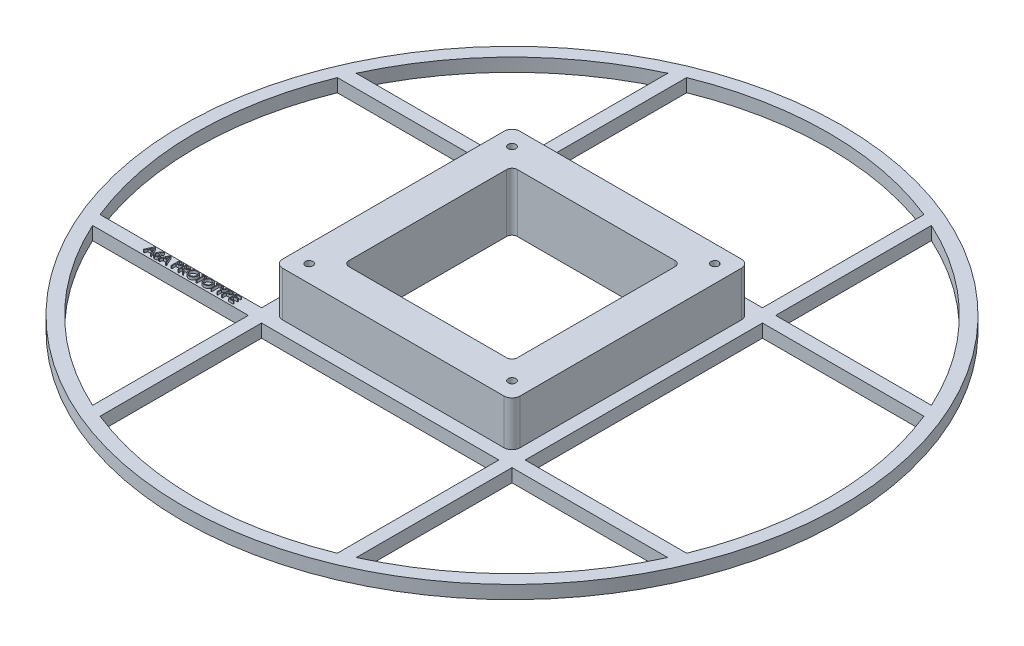
from build123d import *

# Parameters (mm, degrees)
SKETCH1_R                                     = 125
SKETCH1_R_2                                   = 120
BOSS_EXTRUDE1_DEPTH                           = 5
SKETCH1_W                                     = 100
SKETCH1_H                                     = 100
BOSS_EXTRUDE1_2_DEPTH                         = 5
BOSS_EXTRUDE2_REACH                           = 217.116
BOSS_EXTRUDE2_END_RADIUS                      = 120
SKETCH2_W                                     = 5
SKETCH2_H                                     = 5
MIRROR1_AT_THE_SECOND_PLANE_COPY_1_REACH      = 217.116
MIRROR1_AT_THE_SECOND_PLANE_COPY_1_END_RADIUS = 120
MIRROR1_AT_THE_SECOND_PLANE_COPY_1_SKETC_W    = 5
MIRROR1_AT_THE_SECOND_PLANE_COPY_1_SKETC_H    = 5
MIRROR3_COPY_1_REACH                          = 217.116
MIRROR3_COPY_1_END_RADIUS                     = 120
MIRROR3_COPY_1_SKETCH_W                       = 5
MIRROR3_COPY_1_SKETCH_H                       = 5
MIRROR3_COPY_2_REACH                          = 217.116
MIRROR3_COPY_2_END_RADIUS                     = 120
MIRROR3_COPY_2_SKETCH_W                       = 5
MIRROR3_COPY_2_SKETCH_H                       = 5
MIRROR3_COPY_3_REACH                          = 217.116
MIRROR3_COPY_3_END_RADIUS                     = 120
MIRROR3_COPY_3_SKETCH_W                       = 5
MIRROR3_COPY_3_SKETCH_H                       = 5
SKETCH8_W                                     = 90
SKETCH8_H                                     = 90
BOSS_EXTRUDE3_DEPTH                           = 17
FILLET1_R                                     = 3
SKETCH9_R                                     = 1.45
CUT_EXTRUDE1_DEPTH                            = 15
BOSS_EXTRUDE4_DEPTH                           = 1
CUT_EXTRUDE2_REACH                            = 180.14
SKETCH13_W                                    = 63.857864376
SKETCH13_H                                    = 63.857864376
FILLET2_R                                     = 2


with BuildPart() as part:
    # Sketch1 → Boss-Extrude1 (new body)
    with BuildSketch(Plane(origin=(0, 0, 0), x_dir=(1, 0, 0), z_dir=(0, 1, 0))):
        with Locations(Location((0, 0, 0), (0, 0, 270))):
            Circle(SKETCH1_R)
        with Locations(Location((0, 0, 0), (0, 0, 270))):
            Circle(SKETCH1_R_2, mode=Mode.SUBTRACT)
    extrude(amount=BOSS_EXTRUDE1_DEPTH)



with BuildPart() as body_2:
    # Sketch1 → Boss-Extrude1 2 (new body)
    with BuildSketch(Plane(origin=(0, 0, 0), x_dir=(1, 0, 0), z_dir=(0, 1, 0))):
        Rectangle(SKETCH1_W, SKETCH1_H)
    extrude(amount=BOSS_EXTRUDE1_2_DEPTH)


with BuildPart() as part_1:
    add(part.part)

    add(body_2.part)  # Boss-Extrude2 merges body 2
    # Boss-Extrude2: up to this cylinder (the profile starts inside it)
    boss_extrude2_end = Plane(origin=(0, 2.5, 0), z_dir=(0, -1, 0)) * Cylinder(BOSS_EXTRUDE2_END_RADIUS, 675.232, mode=Mode.PRIVATE)
    # Sketch2 → Boss-Extrude2 (add, up to the surface)
    with BuildSketch(Plane.ZY.offset(50), mode=Mode.PRIVATE) as boss_extrude2_sk1:
        with Locations((-47.5, 2.5)):
            Rectangle(SKETCH2_W, SKETCH2_H)
    boss_extrude2_tool1 = extrude(boss_extrude2_sk1.sketch, amount=BOSS_EXTRUDE2_REACH, mode=Mode.PRIVATE) & boss_extrude2_end
    boss_extrude2 = boss_extrude2_tool1.solids().sort_by_distance((-50, 2.5, -47.5))[0]
    add(boss_extrude2)

    # Mirror1: Boss-Extrude2 across plane
    add(boss_extrude2.mirror(Plane(origin=(0, 0, 0), x_dir=(0, 0, 1), z_dir=(1, 0, 0))))

    # Mirror1 at the second plane: Boss-Extrude2 across plane
    add(boss_extrude2.mirror(Plane.XY))

    # Mirror1 at the second plane copy 1: up to this cylinder (the profile starts inside it)
    mirror1_at_the_second_plane_copy_1_end = Plane(origin=(0, 2.5, 0), z_dir=(0, -1, 0)) * Cylinder(MIRROR1_AT_THE_SECOND_PLANE_COPY_1_END_RADIUS, 675.232, mode=Mode.PRIVATE)
    # Mirror1 at the second plane copy 1 sketc → Mirror1 at the second plane copy 1 (add, up to the surface)
    with BuildSketch(Plane(origin=(50, 0, 0), x_dir=(0, 0, -1), z_dir=(1, 0, 0)), mode=Mode.PRIVATE) as mirror1_at_the_second_plane_copy_1_sk1:
        with Locations((-47.5, 2.5)):
            Rectangle(MIRROR1_AT_THE_SECOND_PLANE_COPY_1_SKETC_W, MIRROR1_AT_THE_SECOND_PLANE_COPY_1_SKETC_H)
    mirror1_at_the_second_plane_copy_1_tool1 = extrude(mirror1_at_the_second_plane_copy_1_sk1.sketch, amount=MIRROR1_AT_THE_SECOND_PLANE_COPY_1_REACH, mode=Mode.PRIVATE) & mirror1_at_the_second_plane_copy_1_end
    add(mirror1_at_the_second_plane_copy_1_tool1.solids().sort_by_distance((-50, 2.5, -47.5))[0])

    # Mirror2: Boss-Extrude2 across plane
    add(boss_extrude2.mirror(Plane(origin=(0, 0, 0), x_dir=(-0.7071067811865414, 0, 0.7071067811865536), z_dir=(-0.7071067811865537, 0, -0.7071067811865414))))

    # Mirror2 at the second plane: Boss-Extrude2 across plane
    add(boss_extrude2.mirror(Plane(origin=(0, 0, 0), x_dir=(0.7071067811865538, 0, 0.7071067811865412), z_dir=(-0.7071067811865412, 0, 0.7071067811865538))))

    # Mirror3 copy 1: up to this cylinder (the profile starts inside it)
    mirror3_copy_1_end = Plane(origin=(0, 2.5, 0), z_dir=(0, -1, 0)) * Cylinder(MIRROR3_COPY_1_END_RADIUS, 675.232, mode=Mode.PRIVATE)
    # Mirror3 copy 1 sketch → Mirror3 copy 1 (add, up to the surface)
    with BuildSketch(Plane.XY.offset(50), mode=Mode.PRIVATE) as mirror3_copy_1_sk1:
        with Locations((-47.5, 2.5)):
            Rectangle(MIRROR3_COPY_1_SKETCH_W, MIRROR3_COPY_1_SKETCH_H)
    mirror3_copy_1_tool1 = extrude(mirror3_copy_1_sk1.sketch, amount=MIRROR3_COPY_1_REACH, mode=Mode.PRIVATE) & mirror3_copy_1_end
    add(mirror3_copy_1_tool1.solids().sort_by_distance((-50, 2.5, -47.5))[0])

    # Mirror3 copy 2: up to this cylinder (the profile starts inside it)
    mirror3_copy_2_end = Plane(origin=(0, 2.5, 0), z_dir=(0, -1, 0)) * Cylinder(MIRROR3_COPY_2_END_RADIUS, 675.232, mode=Mode.PRIVATE)
    # Mirror3 copy 2 sketch → Mirror3 copy 2 (add, up to the surface)
    with BuildSketch(Plane(origin=(0, 0, -50), x_dir=(-1, 0, 0), z_dir=(0, 0, -1)), mode=Mode.PRIVATE) as mirror3_copy_2_sk1:
        with Locations((-47.5, 2.5)):
            Rectangle(MIRROR3_COPY_2_SKETCH_W, MIRROR3_COPY_2_SKETCH_H)
    mirror3_copy_2_tool1 = extrude(mirror3_copy_2_sk1.sketch, amount=MIRROR3_COPY_2_REACH, mode=Mode.PRIVATE) & mirror3_copy_2_end
    add(mirror3_copy_2_tool1.solids().sort_by_distance((-50, 2.5, -47.5))[0])

    # Mirror3 copy 3: up to this cylinder (the profile starts inside it)
    mirror3_copy_3_end = Plane(origin=(0, 2.5, 0), z_dir=(0, -1, 0)) * Cylinder(MIRROR3_COPY_3_END_RADIUS, 675.232, mode=Mode.PRIVATE)
    # Mirror3 copy 3 sketch → Mirror3 copy 3 (add, up to the surface)
    with BuildSketch(Plane(origin=(50, 0, 0), x_dir=(0, 0, 1), z_dir=(1, 0, 0)), mode=Mode.PRIVATE) as mirror3_copy_3_sk1:
        with Locations((-47.5, -2.5)):
            Rectangle(MIRROR3_COPY_3_SKETCH_W, MIRROR3_COPY_3_SKETCH_H)
    mirror3_copy_3_tool1 = extrude(mirror3_copy_3_sk1.sketch, amount=MIRROR3_COPY_3_REACH, mode=Mode.PRIVATE) & mirror3_copy_3_end
    add(mirror3_copy_3_tool1.solids().sort_by_distance((-50, 2.5, -47.5))[0])

    # Sketch8 → Boss-Extrude3 (add)
    with BuildSketch(Plane(origin=(0, 5, 0), x_dir=(1, 0, 0), z_dir=(0, 1, 0))):
        Rectangle(SKETCH8_W, SKETCH8_H)
    extrude(amount=BOSS_EXTRUDE3_DEPTH)

    # Fillet1
    fillet1_edges = [part_1.edges().sort_by_distance(p)[0] for p in [
        (-45, 13.5, -45),
        (-45, 13.5, 45),
        (45, 13.5, 45),
        (45, 13.5, -45),
    ]]
    fillet(fillet1_edges, radius=FILLET1_R)

    # Sketch9 → Cut-Extrude1 (cut)
    with BuildSketch(Plane(origin=(0, 22, 0), x_dir=(1, 0, 0), z_dir=(0, 1, 0))):
        with Locations(Location((-38.464466094, 38.464466094, 0), (0, 0, 270))):
            Circle(SKETCH9_R)
        with Locations(Location((38.464466094, 38.464466094, 0), (0, 0, 270))):
            Circle(SKETCH9_R)
        with Locations(Location((38.464466094, -38.464466094, 0), (0, 0, 270))):
            Circle(SKETCH9_R)
        with Locations(Location((-38.464466094, -38.464466094, 0), (0, 0, 270))):
            Circle(SKETCH9_R)
    extrude(amount=-CUT_EXTRUDE1_DEPTH, mode=Mode.SUBTRACT)

    # Sketch11 → Boss-Extrude4 (add)
    # profile 1 of 12: a face of its own
    with BuildSketch(Plane(origin=(0, 5, 0), x_dir=(1, 0, 0), z_dir=(0, 1, 0))):
        Polygon((-89.096375397, -46.03001149), (-87.630990782, -49.20501149), (-87.940731367, -49.20501149), (-88.410112376, -48.187383284), (-89.849420269, -48.187383284), (-90.331521631, -49.20501149), (-90.643170269, -49.20501149), (-89.137080525, -46.03001149), align=None)
        Polygon((-89.119908049, -46.649492659), (-89.694231968, -47.861742259), (-88.560212537, -47.861742259), align=None, mode=Mode.SUBTRACT)
    # profile 2 of 12: a face of its own
    with BuildSketch(Plane(origin=(0, 5, 0), x_dir=(1, 0, 0), z_dir=(0, 1, 0))):
        with BuildLine():
            Line((-85.880670269, -45.948601233), (-85.66060817, -46.12096201))
            Line((-85.66060817, -46.12096201), (-86.499515421, -47.403809567))
            add(Edge.make_bspline(
                [(-86.499515421, -47.403809567), (-86.443662384, -47.394906993), (-86.334714721, -47.377541517), (-86.224437084, -47.374676809), (-86.170694307, -47.37328072)],
                knots=[0, 0, 0, 0, 1.025318673, 2, 2, 2, 2], degree=3))
            add(Edge.make_bspline(
                [(-86.170694307, -47.37328072), (-86.138423347, -47.374135489), (-86.075109031, -47.375812509), (-85.98207751, -47.389065485), (-85.892662803, -47.409693669), (-85.807064384, -47.439884269), (-85.725173615, -47.47843787), (-85.646522231, -47.524647274), (-85.572588244, -47.580895127), (-85.50241968, -47.64372838), (-85.438713669, -47.713321633), (-85.382311105, -47.787164277), (-85.334933943, -47.865179361), (-85.296494743, -47.947327376), (-85.266645318, -48.03348169), (-85.244885097, -48.123532073), (-85.23202218, -48.217540623), (-85.230275485, -48.281474396), (-85.229388218, -48.313950792)],
                knots=[0, 0, 0, 0, 1.044136307, 2.048553127, 3.035567123, 4.010001674, 4.980053131, 5.96154148, 6.956538004, 7.981742224, 9.006487041, 10.005615874, 10.984750588, 11.954802044, 12.935714515, 13.930994945, 14.949008866, 16, 16, 16, 16], degree=3))
            add(Edge.make_bspline(
                [(-85.229388218, -48.313950792), (-85.230679177, -48.358382381), (-85.23321948, -48.445813232), (-85.258532209, -48.573154959), (-85.297865601, -48.694469455), (-85.354088073, -48.807819832), (-85.423922092, -48.913050734), (-85.50908248, -49.006291835), (-85.606549073, -49.089449655), (-85.716754954, -49.158988159), (-85.8353575, -49.21577807), (-85.959955383, -49.256567968), (-86.08933858, -49.28168083), (-86.177154189, -49.284829162), (-86.221575718, -49.286421746)],
                knots=[0, 0, 0, 0, 1.031375318, 2.029502543, 3.004789286, 3.987476834, 4.960371455, 5.9300674, 6.912260825, 7.929083631, 8.949397511, 9.960523116, 10.96833055, 12, 12, 12, 12], degree=3))
            add(Edge.make_bspline(
                [(-86.221575718, -49.286421746), (-86.264299153, -49.285035445), (-86.348926799, -49.282289426), (-86.473416548, -49.257827468), (-86.593035142, -49.218178882), (-86.706944509, -49.163555929), (-86.812463922, -49.094560564), (-86.906866321, -49.011500496), (-86.989681002, -48.916151196), (-87.058600837, -48.808527452), (-87.113264115, -48.692875848), (-87.154257833, -48.572282856), (-87.178202997, -48.447187873), (-87.181549045, -48.362387125), (-87.183234372, -48.319674951)],
                knots=[0, 0, 0, 0, 1.012016664, 2.004627821, 2.994792927, 3.992885782, 4.990978636, 5.973936114, 6.964471063, 7.975201453, 8.993600317, 9.990122807, 10.98767138, 12, 12, 12, 12], degree=3))
            add(Edge.make_bspline(
                [(-87.183234372, -48.319674951), (-87.182162632, -48.286977365), (-87.179974345, -48.220215141), (-87.164694984, -48.119101345), (-87.140143349, -48.01564072), (-87.112647625, -47.927870845), (-87.083595822, -47.855969321), (-87.059418161, -47.797999726), (-87.029324607, -47.738345038), (-86.997235897, -47.674959669), (-86.960263595, -47.609477169), (-86.92006297, -47.540803126), (-86.875522572, -47.47002972), (-86.844298567, -47.422001772), (-86.828336535, -47.39744939)],
                knots=[0, 0, 0, 0, 1.173818275, 2.396712641, 3.66331629, 4.989737886, 5.693666774, 6.447286557, 7.243889047, 8.091586357, 8.998013824, 9.943181721, 10.948533338, 12, 12, 12, 12], degree=3))
            Line((-86.828336535, -47.39744939), (-85.880670269, -45.948601233))
        make_face()
        with BuildLine():
            add(Edge.make_bspline(
                [(-86.230479964, -47.698921746), (-86.254665656, -47.699636909), (-86.302117783, -47.701040052), (-86.371649339, -47.708964606), (-86.437277824, -47.723980722), (-86.499757166, -47.743400405), (-86.558420474, -47.769856443), (-86.613994988, -47.801558291), (-86.665841077, -47.839539888), (-86.713705654, -47.882416824), (-86.757079985, -47.929404373), (-86.794438439, -47.979720965), (-86.826661997, -48.032167274), (-86.852862021, -48.087178029), (-86.873263709, -48.144733108), (-86.888021343, -48.204567559), (-86.896234387, -48.267082683), (-86.897600754, -48.309475738), (-86.898298474, -48.331123268)],
                knots=[0, 0, 0, 0, 1.128956033, 2.215002439, 3.259141796, 4.2666399, 5.263148119, 6.255916712, 7.247353359, 8.256307737, 9.250603402, 10.226115518, 11.176314381, 12.118911324, 13.063945463, 14.021379252, 14.989639887, 16, 16, 16, 16], degree=3))
            add(Edge.make_bspline(
                [(-86.898298474, -48.331123268), (-86.897730275, -48.352577179), (-86.89661612, -48.394645103), (-86.886499373, -48.456638502), (-86.87104612, -48.516296669), (-86.848058761, -48.573312047), (-86.820638655, -48.628553707), (-86.784438825, -48.680020716), (-86.744327884, -48.730838923), (-86.696381816, -48.777104543), (-86.644925622, -48.820154481), (-86.589951674, -48.857782997), (-86.532656568, -48.889974025), (-86.472266778, -48.915202664), (-86.409639101, -48.935907553), (-86.344251741, -48.950477609), (-86.276059222, -48.958714943), (-86.22986575, -48.96008309), (-86.206311295, -48.96078072)],
                knots=[0, 0, 0, 0, 0.989467248, 1.94019797, 2.891935182, 3.827694429, 4.772920941, 5.730924762, 6.725747692, 7.756678648, 8.79901574, 9.819492441, 10.826891316, 11.826466727, 12.835195252, 13.867842842, 14.912794438, 16, 16, 16, 16], degree=3))
            add(Edge.make_bspline(
                [(-86.206311295, -48.96078072), (-86.182756878, -48.960083036), (-86.136563481, -48.958714781), (-86.068370414, -48.950478224), (-86.002985082, -48.935905294), (-85.940350035, -48.915210852), (-85.879987451, -48.889943649), (-85.822742454, -48.857983265), (-85.768288397, -48.819923072), (-85.716798425, -48.777178112), (-85.669051924, -48.730575597), (-85.627978964, -48.680474349), (-85.592887745, -48.628137744), (-85.564372447, -48.573529658), (-85.541638275, -48.516262194), (-85.526106659, -48.456647737), (-85.516010804, -48.394642685), (-85.514893778, -48.352576362), (-85.514324115, -48.331123268)],
                knots=[0, 0, 0, 0, 1.087397944, 2.132534446, 3.165364764, 4.174271784, 5.174024072, 6.181601208, 7.194203697, 8.236725232, 9.267838612, 10.269026844, 11.221737037, 12.171628256, 13.107553087, 14.05945871, 15.010357665, 16, 16, 16, 16], degree=3))
            add(Edge.make_bspline(
                [(-85.514324115, -48.331123268), (-85.51482331, -48.309447498), (-85.515803068, -48.266905011), (-85.526884669, -48.204595514), (-85.542253856, -48.14442913), (-85.565461194, -48.08678368), (-85.595611965, -48.031887834), (-85.632334361, -47.97945972), (-85.674825399, -47.929115186), (-85.72387151, -47.882296389), (-85.777261952, -47.839804245), (-85.833669118, -47.801415702), (-85.893444065, -47.770151535), (-85.955508292, -47.74331042), (-86.020609347, -47.724288548), (-86.088036143, -47.708917723), (-86.15842759, -47.701106299), (-86.206296427, -47.699654966), (-86.230479964, -47.698921746)],
                knots=[0, 0, 0, 0, 0.978753431, 1.920974676, 2.853199117, 3.782215702, 4.721507756, 5.67862441, 6.671401678, 7.694929396, 8.738190014, 9.75360867, 10.774035531, 11.783329636, 12.805060902, 13.835252836, 14.906360638, 16, 16, 16, 16], degree=3))
        make_face(mode=Mode.SUBTRACT)
    # profile 3 of 12: a face of its own
    with BuildSketch(Plane(origin=(0, 5, 0), x_dir=(1, 0, 0), z_dir=(0, 1, 0))):
        Polygon((-83.316247192, -46.03001149), (-81.850862577, -49.20501149), (-82.160603162, -49.20501149), (-82.629984171, -48.187383284), (-84.069292064, -48.187383284), (-84.551393426, -49.20501149), (-84.863042064, -49.20501149), (-83.35695232, -46.03001149), align=None)
        Polygon((-83.339779844, -46.649492659), (-83.914103763, -47.861742259), (-82.780084331, -47.861742259), align=None, mode=Mode.SUBTRACT)
    # profile 4 of 12: a face of its own
    with BuildSketch(Plane(origin=(0, 5, 0), x_dir=(1, 0, 0), z_dir=(0, 1, 0))):
        with BuildLine():
            Line((-80.059836936, -46.03001149), (-79.437175678, -46.03001149))
            add(Edge.make_bspline(
                [(-79.437175678, -46.03001149), (-79.394348641, -46.030058567), (-79.312290138, -46.030148769), (-79.194620052, -46.032883574), (-79.087749795, -46.036536359), (-78.991909807, -46.041599934), (-78.906805203, -46.047583983), (-78.832821082, -46.055976905), (-78.769375913, -46.064740173), (-78.731360776, -46.073649592), (-78.714023634, -46.077712812)],
                knots=[0, 0, 0, 0, 1.415646017, 2.712440637, 3.8905458, 4.950247383, 5.884950622, 6.709939814, 7.411656543, 8, 8, 8, 8], degree=3))
            add(Edge.make_bspline(
                [(-78.714023634, -46.077712812), (-78.692076643, -46.083719866), (-78.648699814, -46.095592426), (-78.586196725, -46.119372018), (-78.526730022, -46.147567983), (-78.47009568, -46.179702557), (-78.416989647, -46.217154461), (-78.366619596, -46.258405529), (-78.319430042, -46.304408166), (-78.275686351, -46.354646409), (-78.235513713, -46.408276885), (-78.200924644, -46.466100193), (-78.171962088, -46.527143018), (-78.147121549, -46.591362901), (-78.129243165, -46.659299123), (-78.115774906, -46.730479641), (-78.107226329, -46.804896824), (-78.106407577, -46.855751132), (-78.105990782, -46.881639094)],
                knots=[0, 0, 0, 0, 0.999701418, 1.975846123, 2.934577507, 3.890451536, 4.834027766, 5.787354733, 6.749476667, 7.726910423, 8.712836071, 9.690891519, 10.682875813, 11.679750201, 12.712814741, 13.765529915, 14.8625177, 16, 16, 16, 16], degree=3))
            add(Edge.make_bspline(
                [(-78.105990782, -46.881639094), (-78.106373074, -46.907744648), (-78.107121055, -46.958821929), (-78.1160984, -47.033545816), (-78.128190788, -47.104954641), (-78.146784542, -47.172890071), (-78.171137403, -47.236948663), (-78.199705194, -47.298109352), (-78.234161682, -47.355331626), (-78.273753778, -47.408823225), (-78.31779701, -47.45863436), (-78.366105032, -47.504404066), (-78.418482819, -47.545864431), (-78.47476391, -47.583108399), (-78.535496988, -47.61527231), (-78.599760941, -47.644080722), (-78.668114352, -47.668275185), (-78.715415061, -47.681002455), (-78.739464339, -47.687473429)],
                knots=[0, 0, 0, 0, 1.121902311, 2.195077645, 3.232258892, 4.234102512, 5.217864754, 6.176164875, 7.132989551, 8.084763148, 9.034132444, 9.988522005, 10.94243251, 11.903244335, 12.886203696, 13.894208494, 14.929344452, 16, 16, 16, 16], degree=3))
            add(Edge.make_bspline(
                [(-78.739464339, -47.687473429), (-78.759355564, -47.691703419), (-78.802948339, -47.700973688), (-78.874742094, -47.711322788), (-78.958331122, -47.720156183), (-79.053601334, -47.726779357), (-79.160467212, -47.732449335), (-79.278986566, -47.736956105), (-79.409392051, -47.739432473), (-79.500352394, -47.739560192), (-79.547842745, -47.739626874)],
                knots=[0, 0, 0, 0, 0.601384939, 1.31797006, 2.144135048, 3.087295005, 4.142315834, 5.309527816, 6.595305764, 8, 8, 8, 8], degree=3))
            Line((-79.547842745, -47.739626874), (-79.774901038, -47.739626874))
            Line((-79.774901038, -47.739626874), (-79.774901038, -49.20501149))
            Line((-79.774901038, -49.20501149), (-80.059836936, -49.20501149))
            Line((-80.059836936, -49.20501149), (-80.059836936, -46.03001149))
        make_face()
        with BuildLine():
            Line((-79.774901038, -46.355652515), (-79.774901038, -47.413985849))
            Line((-79.774901038, -47.413985849), (-79.219021631, -47.420982042))
            add(Edge.make_bspline(
                [(-79.219021631, -47.420982042), (-79.191879984, -47.42099607), (-79.139483594, -47.42102315), (-79.06379502, -47.417407983), (-78.993573738, -47.413234643), (-78.929035445, -47.407124198), (-78.870151047, -47.398487057), (-78.81682236, -47.389767838), (-78.769462896, -47.377153688), (-78.714037192, -47.360169189), (-78.65227587, -47.331201745), (-78.585086022, -47.289155773), (-78.528144133, -47.235561131), (-78.478869678, -47.175301598), (-78.439766489, -47.108264531), (-78.411140696, -47.03653771), (-78.394321217, -46.960856732), (-78.392065885, -46.909069634), (-78.390926679, -46.882911129)],
                knots=[0, 0, 0, 0, 1.160613943, 2.240541288, 3.23993089, 4.169200891, 5.011653406, 5.7853311, 6.478053781, 7.106038997, 8.262395093, 9.384106736, 10.481365981, 11.59014053, 12.70357646, 13.786202915, 14.881775077, 16, 16, 16, 16], degree=3))
            add(Edge.make_bspline(
                [(-78.390926679, -46.882911129), (-78.39207208, -46.857385478), (-78.394348995, -46.806643642), (-78.411272528, -46.732277194), (-78.439710834, -46.661306234), (-78.479132173, -46.595109221), (-78.526975913, -46.53506652), (-78.582583174, -46.482908412), (-78.645823061, -46.440978725), (-78.704649671, -46.413915676), (-78.756902175, -46.397391819), (-78.80228831, -46.385830428), (-78.853533422, -46.3765997), (-78.910654193, -46.369125294), (-78.973207893, -46.362726797), (-79.041731935, -46.358385232), (-79.11596674, -46.355843911), (-79.167502044, -46.355717858), (-79.194216944, -46.355652515)],
                knots=[0, 0, 0, 0, 1.120700087, 2.227813068, 3.331159281, 4.466773991, 5.599788987, 6.693661531, 7.80175334, 8.91857717, 9.525282508, 10.207424825, 10.974604443, 11.810962634, 12.737642355, 13.736264703, 14.826523623, 16, 16, 16, 16], degree=3))
            Line((-79.194216944, -46.355652515), (-79.774901038, -46.355652515))
        make_face(mode=Mode.SUBTRACT)
    # profile 5 of 12: a face of its own
    with BuildSketch(Plane(origin=(0, 5, 0), x_dir=(1, 0, 0), z_dir=(0, 1, 0))):
        with BuildLine():
            Line((-77.45470873, -46.03001149), (-76.81932712, -46.03001149))
            add(Edge.make_bspline(
                [(-76.81932712, -46.03001149), (-76.776926239, -46.030152628), (-76.695511851, -46.03042363), (-76.578877527, -46.031934715), (-76.472898661, -46.036265738), (-76.377630663, -46.03999281), (-76.293075284, -46.046789071), (-76.218973241, -46.053284801), (-76.15566583, -46.06178805), (-76.117342808, -46.069685113), (-76.099991182, -46.073260688)],
                knots=[0, 0, 0, 0, 1.410062039, 2.707475311, 3.878576406, 4.937260626, 5.877586885, 6.699081471, 7.410979367, 8, 8, 8, 8], degree=3))
            add(Edge.make_bspline(
                [(-76.099991182, -46.073260688), (-76.076762316, -46.078999968), (-76.030800119, -46.090356094), (-75.964623987, -46.114358732), (-75.901564565, -46.142135106), (-75.841883796, -46.174759338), (-75.785880614, -46.212473602), (-75.732977575, -46.254626827), (-75.682934619, -46.300988364), (-75.637775568, -46.352727113), (-75.595195143, -46.407007375), (-75.559282603, -46.465702926), (-75.528325011, -46.527081598), (-75.50367747, -46.591767612), (-75.483831023, -46.659133648), (-75.46983722, -46.729789914), (-75.461445071, -46.803414513), (-75.460590674, -46.853632044), (-75.460157448, -46.879095023)],
                knots=[0, 0, 0, 0, 1.027469482, 2.033020251, 3.019912614, 3.986113645, 4.951240523, 5.91722682, 6.890402269, 7.87763091, 8.8651537, 9.85103654, 10.82876324, 11.815024772, 12.821070561, 13.842952187, 14.906261191, 16, 16, 16, 16], degree=3))
            add(Edge.make_bspline(
                [(-75.460157448, -46.879095023), (-75.46149004, -46.921399725), (-75.46409027, -47.003947156), (-75.488333757, -47.123745241), (-75.528045314, -47.235495548), (-75.582767155, -47.33905737), (-75.652453394, -47.432412027), (-75.736205168, -47.514409083), (-75.834069202, -47.583025289), (-75.925172938, -47.630607476), (-76.005649391, -47.661081043), (-76.071901039, -47.682522597), (-76.144170368, -47.699088809), (-76.221764951, -47.713929785), (-76.305007695, -47.725134537), (-76.393699088, -47.73334109), (-76.487902383, -47.73847012), (-76.55261711, -47.739233939), (-76.58590865, -47.739626874)],
                knots=[0, 0, 0, 0, 1.260483769, 2.459530307, 3.627416485, 4.787058657, 5.939039949, 7.08810263, 8.267026773, 9.491475466, 10.141966685, 10.831826277, 11.566392101, 12.351337768, 13.187381173, 14.07005841, 15.007169909, 16, 16, 16, 16], degree=3))
            Line((-76.58590865, -47.739626874), (-75.41945232, -49.20501149))
            Line((-75.41945232, -49.20501149), (-75.771806086, -49.20501149))
            Line((-75.771806086, -49.20501149), (-76.938262416, -47.739626874))
            Line((-76.938262416, -47.739626874), (-77.169772833, -47.739626874))
            Line((-77.169772833, -47.739626874), (-77.169772833, -49.20501149))
            Line((-77.169772833, -49.20501149), (-77.45470873, -49.20501149))
            Line((-77.45470873, -49.20501149), (-77.45470873, -46.03001149))
        make_face()
        with BuildLine():
            Line((-77.169772833, -46.355652515), (-77.169772833, -47.413985849))
            Line((-77.169772833, -47.413985849), (-76.588452721, -47.418437972))
            add(Edge.make_bspline(
                [(-76.588452721, -47.418437972), (-76.561310971, -47.418449979), (-76.50870253, -47.418473254), (-76.432592641, -47.414850328), (-76.36172654, -47.410728889), (-76.296375286, -47.40442484), (-76.236509686, -47.396300404), (-76.182159661, -47.386137696), (-76.133236492, -47.374297611), (-76.076178533, -47.35597185), (-76.012463965, -47.32693782), (-75.943220426, -47.28469626), (-75.88425402, -47.231565702), (-75.834435673, -47.17081121), (-75.794403975, -47.104012613), (-75.766180897, -47.031970621), (-75.748271681, -46.956503957), (-75.746159358, -46.904635244), (-75.745093346, -46.878459006)],
                knots=[0, 0, 0, 0, 1.146690395, 2.22261258, 3.21895312, 4.145990853, 4.996080663, 5.770904154, 6.481378293, 7.121626537, 8.300444488, 9.431385265, 10.535395872, 11.636531494, 12.74115979, 13.810798291, 14.895190096, 16, 16, 16, 16], degree=3))
            add(Edge.make_bspline(
                [(-75.745093346, -46.878459006), (-75.746183841, -46.852926042), (-75.748344806, -46.802329026), (-75.765987617, -46.72825545), (-75.795822985, -46.658344717), (-75.836029586, -46.59288122), (-75.885014534, -46.533458159), (-75.942452835, -46.482615385), (-76.006773977, -46.440660513), (-76.066891421, -46.413850468), (-76.120625314, -46.397413172), (-76.167279362, -46.385846045), (-76.219994774, -46.376552849), (-76.279027512, -46.369106965), (-76.344125563, -46.362707122), (-76.415618082, -46.35839658), (-76.493030732, -46.355844004), (-76.546685449, -46.35571783), (-76.574460333, -46.355652515)],
                knots=[0, 0, 0, 0, 1.101028733, 2.181837193, 3.264309656, 4.369019818, 5.486613113, 6.575447106, 7.666700264, 8.788928104, 9.402425223, 10.0903467, 10.862060571, 11.710948788, 12.657782767, 13.684531032, 14.801375019, 16, 16, 16, 16], degree=3))
            Line((-76.574460333, -46.355652515), (-77.169772833, -46.355652515))
        make_face(mode=Mode.SUBTRACT)
    # profile 6 of 12: a face of its own
    with BuildSketch(Plane(origin=(0, 5, 0), x_dir=(1, 0, 0), z_dir=(0, 1, 0))):
        with BuildLine():
            add(Edge.make_bspline(
                [(-73.282433089, -45.948601233), (-73.223642879, -45.950090289), (-73.108174056, -45.953014919), (-72.938470398, -45.975402391), (-72.776459133, -46.014133209), (-72.620820507, -46.065716058), (-72.473416164, -46.134526822), (-72.333136598, -46.217698349), (-72.200315576, -46.316101994), (-72.076743323, -46.428977078), (-71.963661661, -46.551789211), (-71.864033893, -46.682851316), (-71.780538383, -46.821370943), (-71.711971277, -46.96693184), (-71.658178966, -47.119204811), (-71.621059548, -47.279001656), (-71.597348512, -47.445287011), (-71.594576485, -47.558704238), (-71.593170269, -47.616239454)],
                knots=[0, 0, 0, 0, 1.065120563, 2.091984664, 3.0946048, 4.079830382, 5.057816894, 6.036188127, 7.030412546, 8.04752943, 9.064399622, 10.05169764, 11.02544977, 11.989514704, 12.962713494, 13.945757189, 14.957906945, 16, 16, 16, 16], degree=3))
            add(Edge.make_bspline(
                [(-71.593170269, -47.616239454), (-71.594576279, -47.673350852), (-71.597347688, -47.785924033), (-71.621086508, -47.951154158), (-71.658316558, -48.109986433), (-71.711471742, -48.262155703), (-71.779711998, -48.407822493), (-71.863763474, -48.546603516), (-71.962770144, -48.678544268), (-72.075443502, -48.802199328), (-72.19827159, -48.915589891), (-72.330016189, -49.014394871), (-72.467714415, -49.099416041), (-72.613138222, -49.167255517), (-72.764358969, -49.221477188), (-72.922730077, -49.258445645), (-73.087509451, -49.282291748), (-73.199878147, -49.285029974), (-73.256992384, -49.286421746)],
                knots=[0, 0, 0, 0, 1.043624062, 2.057103931, 3.04512605, 4.022047818, 4.998200453, 5.980619268, 6.982898556, 8.009068085, 9.034988726, 10.034168286, 11.015286542, 11.987931943, 12.962482838, 13.94673481, 14.956375938, 16, 16, 16, 16], degree=3))
            add(Edge.make_bspline(
                [(-73.256992384, -49.286421746), (-73.314527302, -49.285016231), (-73.427943941, -49.282245586), (-73.594438252, -49.258495312), (-73.754347348, -49.2213557), (-73.907213938, -49.168279283), (-74.053123267, -49.099683653), (-74.192360699, -49.016041109), (-74.324367354, -48.916793202), (-74.448048796, -48.804156381), (-74.56121414, -48.681536473), (-74.65987443, -48.550151113), (-74.743535783, -48.412577949), (-74.811901092, -48.268435195), (-74.86602528, -48.118419672), (-74.902950365, -47.961530696), (-74.926840836, -47.798662715), (-74.929593875, -47.687770943), (-74.930990782, -47.631503877)],
                knots=[0, 0, 0, 0, 1.053102029, 2.075944431, 3.073151272, 4.055350789, 5.033113405, 6.020478099, 7.024410459, 8.052272461, 9.079885166, 10.07527673, 11.055994387, 12.023226415, 12.992069828, 13.970394897, 14.97016774, 16, 16, 16, 16], degree=3))
            add(Edge.make_bspline(
                [(-74.930990782, -47.631503877), (-74.930505791, -47.593737099), (-74.929541928, -47.518679987), (-74.917938035, -47.407222428), (-74.901099921, -47.297557332), (-74.876968186, -47.189996543), (-74.845407174, -47.084803364), (-74.80816712, -46.981252315), (-74.762683118, -46.880392794), (-74.711265673, -46.781747003), (-74.653878175, -46.686852688), (-74.590490888, -46.597154781), (-74.523330233, -46.511900591), (-74.44970344, -46.43329938), (-74.372037093, -46.359064563), (-74.289071279, -46.290336956), (-74.201312243, -46.226496822), (-74.10838237, -46.168965512), (-74.012571506, -46.116932583), (-73.913804715, -46.072281333), (-73.813423396, -46.03395812), (-73.710957394, -46.0028968), (-73.606678808, -45.978374881), (-73.500360046, -45.961676782), (-73.39208581, -45.950043293), (-73.319141256, -45.949083988), (-73.282433089, -45.948601233)],
                knots=[0, 0, 0, 0, 1.037015668, 2.060948919, 3.074880161, 4.083647147, 5.086022904, 6.090072063, 7.104153813, 8.122640571, 9.144368836, 10.147691507, 11.138137339, 12.123020368, 13.103399296, 14.087645067, 15.080126199, 16.082011238, 17.087798457, 18.072939717, 19.057185487, 20.037253025, 21.01195951, 21.997135196, 22.992090687, 24, 24, 24, 24], degree=3))
        make_face()
        with BuildLine():
            add(Edge.make_bspline(
                [(-73.268440702, -46.274242259), (-73.298571119, -46.274609552), (-73.358543906, -46.275340627), (-73.447702021, -46.284970598), (-73.535687561, -46.298695569), (-73.622518696, -46.318273091), (-73.707832116, -46.344946767), (-73.792423043, -46.375645306), (-73.875520099, -46.413038724), (-73.956848956, -46.45528682), (-74.035693346, -46.502049055), (-74.110090582, -46.553730586), (-74.180233266, -46.609119418), (-74.245949658, -46.668344813), (-74.307046793, -46.73170838), (-74.3647272, -46.798249519), (-74.416678892, -46.869870163), (-74.464290809, -46.944628175), (-74.506897349, -47.022426181), (-74.544784493, -47.102445127), (-74.575776129, -47.185337743), (-74.601051285, -47.270204729), (-74.622006113, -47.356911674), (-74.635281173, -47.446116337), (-74.645016956, -47.537370475), (-74.645706244, -47.599039728), (-74.646054884, -47.630231842)],
                knots=[0, 0, 0, 0, 1.008559885, 2.007477868, 2.99961109, 3.989939068, 4.984837346, 5.991145699, 7.001802488, 8.033829008, 9.059044045, 10.069351652, 11.065060232, 12.050310815, 13.029377138, 14.011219647, 14.996725999, 15.989392538, 16.977580475, 17.965360261, 18.951710183, 19.937753436, 20.929683414, 21.935841486, 22.955955122, 24, 24, 24, 24], degree=3))
            add(Edge.make_bspline(
                [(-74.646054884, -47.630231842), (-74.644898402, -47.676099), (-74.642623245, -47.766333888), (-74.622704592, -47.898566418), (-74.592023229, -48.025646507), (-74.546795475, -48.14687881), (-74.490234561, -48.263305409), (-74.420360167, -48.373893476), (-74.33757514, -48.478672898), (-74.243537512, -48.576912177), (-74.140737628, -48.666579443), (-74.031578652, -48.745286249), (-73.917230022, -48.811879833), (-73.797393545, -48.866131577), (-73.672708992, -48.909120839), (-73.542372928, -48.938583597), (-73.407253583, -48.957974189), (-73.315150774, -48.959836332), (-73.268440702, -48.96078072)],
                knots=[0, 0, 0, 0, 1.032063989, 2.030389145, 3.003944642, 3.970395727, 4.937377036, 5.913328081, 6.909231446, 7.93887556, 8.970685674, 9.976071282, 10.964166581, 11.944589148, 12.933237628, 13.927779006, 14.949070134, 16, 16, 16, 16], degree=3))
            add(Edge.make_bspline(
                [(-73.268440702, -48.96078072), (-73.237044939, -48.96034937), (-73.174777714, -48.959493873), (-73.08216249, -48.950877216), (-72.991215783, -48.937059734), (-72.902065158, -48.917165497), (-72.814811793, -48.892266959), (-72.729091508, -48.862687092), (-72.645817344, -48.825783429), (-72.563938777, -48.785009215), (-72.485565044, -48.738527072), (-72.410747954, -48.688599608), (-72.341373315, -48.633292359), (-72.275706086, -48.574946915), (-72.214358111, -48.512386853), (-72.157744247, -48.445693509), (-72.106055127, -48.374445913), (-72.05846129, -48.299801295), (-72.016004045, -48.221790408), (-71.979011576, -48.141481343), (-71.947627957, -48.059071851), (-71.922292813, -47.974443069), (-71.902439573, -47.887755727), (-71.888759931, -47.798893756), (-71.87919099, -47.708034924), (-71.878469742, -47.646581569), (-71.878106166, -47.615603437)],
                knots=[0, 0, 0, 0, 1.047197238, 2.076906641, 3.100256066, 4.114471768, 5.12198147, 6.126382909, 7.136867548, 8.15857795, 9.17633901, 10.174870724, 11.156907918, 12.133735059, 13.104061851, 14.077631395, 15.04955518, 16.038496417, 17.029181396, 18.010275684, 18.986308667, 19.968651475, 20.955262928, 21.950658345, 22.966943676, 24, 24, 24, 24], degree=3))
            add(Edge.make_bspline(
                [(-71.878106166, -47.615603437), (-71.878470033, -47.584837229), (-71.87919183, -47.523806789), (-71.88875536, -47.433581619), (-71.902454025, -47.345359062), (-71.92219591, -47.25948547), (-71.947641407, -47.175938951), (-71.979017057, -47.094797972), (-72.01601515, -47.015760252), (-72.058476896, -46.93902114), (-72.106206965, -46.865384056), (-72.158362457, -46.794987582), (-72.21584388, -46.729153738), (-72.277008917, -46.666257266), (-72.343385363, -46.607639609), (-72.414672544, -46.553281322), (-72.490005023, -46.501870566), (-72.569767586, -46.455492378), (-72.652085316, -46.412662324), (-72.736552978, -46.375967485), (-72.822213661, -46.344787063), (-72.908849534, -46.318192387), (-72.997189807, -46.298772246), (-73.086637567, -46.284958229), (-73.177069058, -46.275343979), (-73.237886836, -46.274610664), (-73.268440702, -46.274242259)],
                knots=[0, 0, 0, 0, 1.02996197, 2.043119294, 3.035359645, 4.018872909, 4.991431989, 5.957985074, 6.929999688, 7.912076566, 8.892894881, 9.867085534, 10.843653904, 11.817741046, 12.803660682, 13.806313499, 14.818574707, 15.856120519, 16.894564902, 17.924820532, 18.937903209, 19.946497019, 20.957711757, 21.963978472, 22.977135795, 24, 24, 24, 24], degree=3))
        make_face(mode=Mode.SUBTRACT)
    # profile 7 of 12: a face of its own
    with BuildSketch(Plane(origin=(0, 5, 0), x_dir=(1, 0, 0), z_dir=(0, 1, 0))):
        Polygon((-71.308234372, -46.355652515), (-71.308234372, -46.03001149), (-69.639324115, -46.03001149), (-69.639324115, -46.355652515), (-70.331311295, -46.355652515), (-70.331311295, -49.20501149), (-70.616247192, -49.20501149), (-70.616247192, -46.355652515), align=None)
    # profile 8 of 12: a face of its own
    with BuildSketch(Plane(origin=(0, 5, 0), x_dir=(1, 0, 0), z_dir=(0, 1, 0))):
        with BuildLine():
            add(Edge.make_bspline(
                [(-67.665125397, -45.948601233), (-67.606335187, -45.950090289), (-67.490866363, -45.953014919), (-67.321162706, -45.975402391), (-67.159151441, -46.014133209), (-67.003512815, -46.065716058), (-66.856108472, -46.134526822), (-66.715828905, -46.217698349), (-66.583007884, -46.316101994), (-66.459435631, -46.428977078), (-66.346353969, -46.551789211), (-66.2467262, -46.682851316), (-66.163230691, -46.821370943), (-66.094663584, -46.96693184), (-66.040871274, -47.119204811), (-66.003751856, -47.279001656), (-65.98004082, -47.445287011), (-65.977268793, -47.558704238), (-65.975862577, -47.616239454)],
                knots=[0, 0, 0, 0, 1.065120563, 2.091984664, 3.0946048, 4.079830382, 5.057816894, 6.036188127, 7.030412546, 8.04752943, 9.064399622, 10.05169764, 11.02544977, 11.989514704, 12.962713494, 13.945757189, 14.957906945, 16, 16, 16, 16], degree=3))
            add(Edge.make_bspline(
                [(-65.975862577, -47.616239454), (-65.977268587, -47.673350852), (-65.980039996, -47.785924033), (-66.003778816, -47.951154158), (-66.041008865, -48.109986433), (-66.09416405, -48.262155703), (-66.162404305, -48.407822493), (-66.246455782, -48.546603516), (-66.345462452, -48.678544268), (-66.458135809, -48.802199328), (-66.580963898, -48.915589891), (-66.712708497, -49.014394871), (-66.850406723, -49.099416041), (-66.995830529, -49.167255517), (-67.147051277, -49.221477188), (-67.305422384, -49.258445645), (-67.470201758, -49.282291748), (-67.582570455, -49.285029974), (-67.639684692, -49.286421746)],
                knots=[0, 0, 0, 0, 1.043624062, 2.057103931, 3.04512605, 4.022047818, 4.998200453, 5.980619268, 6.982898556, 8.009068085, 9.034988726, 10.034168286, 11.015286542, 11.987931943, 12.962482838, 13.94673481, 14.956375938, 16, 16, 16, 16], degree=3))
            add(Edge.make_bspline(
                [(-67.639684692, -49.286421746), (-67.69721961, -49.285016231), (-67.810636249, -49.282245586), (-67.977130559, -49.258495312), (-68.137039656, -49.2213557), (-68.289906246, -49.168279283), (-68.435815575, -49.099683653), (-68.575053007, -49.016041109), (-68.707059662, -48.916793202), (-68.830741103, -48.804156381), (-68.943906447, -48.681536473), (-69.042566738, -48.550151113), (-69.126228091, -48.412577949), (-69.1945934, -48.268435195), (-69.248717588, -48.118419672), (-69.285642673, -47.961530696), (-69.309533144, -47.798662715), (-69.312286183, -47.687770943), (-69.313683089, -47.631503877)],
                knots=[0, 0, 0, 0, 1.053102029, 2.075944431, 3.073151272, 4.055350789, 5.033113405, 6.020478099, 7.024410459, 8.052272461, 9.079885166, 10.07527673, 11.055994387, 12.023226415, 12.992069828, 13.970394897, 14.97016774, 16, 16, 16, 16], degree=3))
            add(Edge.make_bspline(
                [(-69.313683089, -47.631503877), (-69.313198099, -47.593737099), (-69.312234236, -47.518679987), (-69.300630343, -47.407222428), (-69.283792228, -47.297557332), (-69.259660493, -47.189996543), (-69.228099481, -47.084803364), (-69.190859428, -46.981252315), (-69.145375425, -46.880392794), (-69.09395798, -46.781747003), (-69.036570483, -46.686852688), (-68.973183196, -46.597154781), (-68.90602254, -46.511900591), (-68.832395747, -46.43329938), (-68.754729401, -46.359064563), (-68.671763586, -46.290336956), (-68.58400455, -46.226496822), (-68.491074677, -46.168965512), (-68.395263814, -46.116932583), (-68.296497022, -46.072281333), (-68.196115704, -46.03395812), (-68.093649702, -46.0028968), (-67.989371116, -45.978374881), (-67.883052354, -45.961676782), (-67.774778117, -45.950043293), (-67.701833564, -45.949083988), (-67.665125397, -45.948601233)],
                knots=[0, 0, 0, 0, 1.037015668, 2.060948919, 3.074880161, 4.083647147, 5.086022904, 6.090072063, 7.104153813, 8.122640571, 9.144368836, 10.147691507, 11.138137339, 12.123020368, 13.103399296, 14.087645067, 15.080126199, 16.082011238, 17.087798457, 18.072939717, 19.057185487, 20.037253025, 21.01195951, 21.997135196, 22.992090687, 24, 24, 24, 24], degree=3))
        make_face()
        with BuildLine():
            add(Edge.make_bspline(
                [(-67.651133009, -46.274242259), (-67.681263427, -46.274609552), (-67.741236213, -46.275340627), (-67.830394328, -46.284970598), (-67.918379868, -46.298695569), (-68.005211004, -46.318273091), (-68.090524424, -46.344946767), (-68.175115351, -46.375645306), (-68.258212407, -46.413038724), (-68.339541264, -46.45528682), (-68.418385653, -46.502049055), (-68.49278289, -46.553730586), (-68.562925574, -46.609119418), (-68.628641966, -46.668344813), (-68.6897391, -46.73170838), (-68.747419508, -46.798249519), (-68.7993712, -46.869870163), (-68.846983116, -46.944628175), (-68.889589657, -47.022426181), (-68.9274768, -47.102445127), (-68.958468437, -47.185337743), (-68.983743592, -47.270204729), (-69.004698421, -47.356911674), (-69.017973481, -47.446116337), (-69.027709264, -47.537370475), (-69.028398552, -47.599039728), (-69.028747192, -47.630231842)],
                knots=[0, 0, 0, 0, 1.008559885, 2.007477868, 2.99961109, 3.989939068, 4.984837346, 5.991145699, 7.001802488, 8.033829008, 9.059044045, 10.069351652, 11.065060232, 12.050310815, 13.029377138, 14.011219647, 14.996725999, 15.989392538, 16.977580475, 17.965360261, 18.951710183, 19.937753436, 20.929683414, 21.935841486, 22.955955122, 24, 24, 24, 24], degree=3))
            add(Edge.make_bspline(
                [(-69.028747192, -47.630231842), (-69.02759071, -47.676099), (-69.025315552, -47.766333888), (-69.0053969, -47.898566418), (-68.974715537, -48.025646507), (-68.929487783, -48.14687881), (-68.872926868, -48.263305409), (-68.803052475, -48.373893476), (-68.720267447, -48.478672898), (-68.62622982, -48.576912177), (-68.523429936, -48.666579443), (-68.414270959, -48.745286249), (-68.29992233, -48.811879833), (-68.180085853, -48.866131577), (-68.0554013, -48.909120839), (-67.925065236, -48.938583597), (-67.78994589, -48.957974189), (-67.697843082, -48.959836332), (-67.651133009, -48.96078072)],
                knots=[0, 0, 0, 0, 1.032063989, 2.030389145, 3.003944642, 3.970395727, 4.937377036, 5.913328081, 6.909231446, 7.93887556, 8.970685674, 9.976071282, 10.964166581, 11.944589148, 12.933237628, 13.927779006, 14.949070134, 16, 16, 16, 16], degree=3))
            add(Edge.make_bspline(
                [(-67.651133009, -48.96078072), (-67.619737247, -48.96034937), (-67.557470021, -48.959493873), (-67.464854797, -48.950877216), (-67.373908091, -48.937059734), (-67.284757466, -48.917165497), (-67.197504101, -48.892266959), (-67.111783815, -48.862687092), (-67.028509652, -48.825783429), (-66.946631085, -48.785009215), (-66.868257351, -48.738527072), (-66.793440261, -48.688599608), (-66.724065623, -48.633292359), (-66.658398393, -48.574946915), (-66.597050418, -48.512386853), (-66.540436554, -48.445693509), (-66.488747434, -48.374445913), (-66.441153598, -48.299801295), (-66.398696352, -48.221790408), (-66.361703884, -48.141481343), (-66.330320264, -48.059071851), (-66.304985121, -47.974443069), (-66.285131881, -47.887755727), (-66.271452239, -47.798893756), (-66.261883298, -47.708034924), (-66.26116205, -47.646581569), (-66.260798474, -47.615603437)],
                knots=[0, 0, 0, 0, 1.047197238, 2.076906641, 3.100256066, 4.114471768, 5.12198147, 6.126382909, 7.136867548, 8.15857795, 9.17633901, 10.174870724, 11.156907918, 12.133735059, 13.104061851, 14.077631395, 15.04955518, 16.038496417, 17.029181396, 18.010275684, 18.986308667, 19.968651475, 20.955262928, 21.950658345, 22.966943676, 24, 24, 24, 24], degree=3))
            add(Edge.make_bspline(
                [(-66.260798474, -47.615603437), (-66.261162341, -47.584837229), (-66.261884138, -47.523806789), (-66.271447668, -47.433581619), (-66.285146333, -47.345359062), (-66.304888218, -47.25948547), (-66.330333715, -47.175938951), (-66.361709364, -47.094797972), (-66.398707458, -47.015760252), (-66.441169204, -46.93902114), (-66.488899272, -46.865384056), (-66.541054765, -46.794987582), (-66.598536188, -46.729153738), (-66.659701224, -46.666257266), (-66.72607767, -46.607639609), (-66.797364851, -46.553281322), (-66.872697331, -46.501870566), (-66.952459894, -46.455492378), (-67.034777624, -46.412662324), (-67.119245285, -46.375967485), (-67.204905969, -46.344787063), (-67.291541842, -46.318192387), (-67.379882115, -46.298772246), (-67.469329874, -46.284958229), (-67.559761366, -46.275343979), (-67.620579144, -46.274610664), (-67.651133009, -46.274242259)],
                knots=[0, 0, 0, 0, 1.02996197, 2.043119294, 3.035359645, 4.018872909, 4.991431989, 5.957985074, 6.929999688, 7.912076566, 8.892894881, 9.867085534, 10.843653904, 11.817741046, 12.803660682, 13.806313499, 14.818574707, 15.856120519, 16.894564902, 17.924820532, 18.937903209, 19.946497019, 20.957711757, 21.963978472, 22.977135795, 24, 24, 24, 24], degree=3))
        make_face(mode=Mode.SUBTRACT)
    # profile 9 of 12: a face of its own
    with BuildSketch(Plane(origin=(0, 5, 0), x_dir=(1, 0, 0), z_dir=(0, 1, 0))):
        Polygon((-65.690926679, -46.355652515), (-65.690926679, -46.03001149), (-64.022016423, -46.03001149), (-64.022016423, -46.355652515), (-64.714003602, -46.355652515), (-64.714003602, -49.20501149), (-64.9989395, -49.20501149), (-64.9989395, -46.355652515), align=None)
    # profile 10 of 12: a face of its own
    with BuildSketch(Plane(origin=(0, 5, 0), x_dir=(1, 0, 0), z_dir=(0, 1, 0))):
        Polygon((-63.777785654, -46.03001149), (-63.45150861, -46.03001149), (-62.618325517, -47.392997267), (-61.784506407, -46.03001149), (-61.457593346, -46.03001149), (-62.475221551, -47.695741658), (-62.475221551, -49.20501149), (-62.760157448, -49.20501149), (-62.760157448, -47.695741658), align=None)
    # profile 11 of 12: a face of its own
    with BuildSketch(Plane(origin=(0, 5, 0), x_dir=(1, 0, 0), z_dir=(0, 1, 0))):
        with BuildLine():
            Line((-60.887721551, -46.03001149), (-60.265060293, -46.03001149))
            add(Edge.make_bspline(
                [(-60.265060293, -46.03001149), (-60.222233257, -46.030058567), (-60.140174753, -46.030148769), (-60.022504667, -46.032883574), (-59.91563441, -46.036536359), (-59.819794422, -46.041599934), (-59.734689819, -46.047583983), (-59.660705697, -46.055976905), (-59.597260528, -46.064740173), (-59.559245392, -46.073649592), (-59.54190825, -46.077712812)],
                knots=[0, 0, 0, 0, 1.415646017, 2.712440637, 3.8905458, 4.950247383, 5.884950622, 6.709939814, 7.411656543, 8, 8, 8, 8], degree=3))
            add(Edge.make_bspline(
                [(-59.54190825, -46.077712812), (-59.519961258, -46.083719866), (-59.476584429, -46.095592426), (-59.41408134, -46.119372018), (-59.354614637, -46.147567983), (-59.297980295, -46.179702557), (-59.244874262, -46.217154461), (-59.194504211, -46.258405529), (-59.147314657, -46.304408166), (-59.103570966, -46.354646409), (-59.063398328, -46.408276885), (-59.028809259, -46.466100193), (-58.999846703, -46.527143018), (-58.975006164, -46.591362901), (-58.95712778, -46.659299123), (-58.943659521, -46.730479641), (-58.935110945, -46.804896824), (-58.934292192, -46.855751132), (-58.933875397, -46.881639094)],
                knots=[0, 0, 0, 0, 0.999701418, 1.975846123, 2.934577507, 3.890451536, 4.834027766, 5.787354733, 6.749476667, 7.726910423, 8.712836071, 9.690891519, 10.682875813, 11.679750201, 12.712814741, 13.765529915, 14.8625177, 16, 16, 16, 16], degree=3))
            add(Edge.make_bspline(
                [(-58.933875397, -46.881639094), (-58.93425769, -46.907744648), (-58.935005671, -46.958821929), (-58.943983015, -47.033545816), (-58.956075403, -47.104954641), (-58.974669158, -47.172890071), (-58.999022018, -47.236948663), (-59.027589809, -47.298109352), (-59.062046297, -47.355331626), (-59.101638393, -47.408823225), (-59.145681625, -47.45863436), (-59.193989648, -47.504404066), (-59.246367434, -47.545864431), (-59.302648526, -47.583108399), (-59.363381603, -47.61527231), (-59.427645557, -47.644080722), (-59.495998967, -47.668275185), (-59.543299676, -47.681002455), (-59.567348955, -47.687473429)],
                knots=[0, 0, 0, 0, 1.121902311, 2.195077645, 3.232258892, 4.234102512, 5.217864754, 6.176164875, 7.132989551, 8.084763148, 9.034132444, 9.988522005, 10.94243251, 11.903244335, 12.886203696, 13.894208494, 14.929344452, 16, 16, 16, 16], degree=3))
            add(Edge.make_bspline(
                [(-59.567348955, -47.687473429), (-59.587240179, -47.691703419), (-59.630832954, -47.700973688), (-59.702626709, -47.711322788), (-59.786215738, -47.720156183), (-59.881485949, -47.726779357), (-59.988351827, -47.732449335), (-60.106871182, -47.736956105), (-60.237276666, -47.739432473), (-60.328237009, -47.739560192), (-60.37572736, -47.739626874)],
                knots=[0, 0, 0, 0, 0.601384939, 1.31797006, 2.144135048, 3.087295005, 4.142315834, 5.309527816, 6.595305764, 8, 8, 8, 8], degree=3))
            Line((-60.37572736, -47.739626874), (-60.602785654, -47.739626874))
            Line((-60.602785654, -47.739626874), (-60.602785654, -49.20501149))
            Line((-60.602785654, -49.20501149), (-60.887721551, -49.20501149))
            Line((-60.887721551, -49.20501149), (-60.887721551, -46.03001149))
        make_face()
        with BuildLine():
            Line((-60.602785654, -46.355652515), (-60.602785654, -47.413985849))
            Line((-60.602785654, -47.413985849), (-60.046906247, -47.420982042))
            add(Edge.make_bspline(
                [(-60.046906247, -47.420982042), (-60.0197646, -47.42099607), (-59.96736821, -47.42102315), (-59.891679636, -47.417407983), (-59.821458354, -47.413234643), (-59.75692006, -47.407124198), (-59.698035663, -47.398487057), (-59.644706976, -47.389767838), (-59.597347512, -47.377153688), (-59.541921807, -47.360169189), (-59.480160485, -47.331201745), (-59.412970637, -47.289155773), (-59.356028748, -47.235561131), (-59.306754293, -47.175301598), (-59.267651104, -47.108264531), (-59.239025311, -47.03653771), (-59.222205833, -46.960856732), (-59.2199505, -46.909069634), (-59.218811295, -46.882911129)],
                knots=[0, 0, 0, 0, 1.160613943, 2.240541288, 3.23993089, 4.169200891, 5.011653406, 5.7853311, 6.478053781, 7.106038997, 8.262395093, 9.384106736, 10.481365981, 11.59014053, 12.70357646, 13.786202915, 14.881775077, 16, 16, 16, 16], degree=3))
            add(Edge.make_bspline(
                [(-59.218811295, -46.882911129), (-59.219956695, -46.857385478), (-59.22223361, -46.806643642), (-59.239157143, -46.732277194), (-59.267595449, -46.661306234), (-59.307016789, -46.595109221), (-59.354860528, -46.53506652), (-59.410467789, -46.482908412), (-59.473707676, -46.440978725), (-59.532534286, -46.413915676), (-59.58478679, -46.397391819), (-59.630172925, -46.385830428), (-59.681418037, -46.3765997), (-59.738538809, -46.369125294), (-59.801092508, -46.362726797), (-59.869616551, -46.358385232), (-59.943851356, -46.355843911), (-59.995386659, -46.355717858), (-60.022101559, -46.355652515)],
                knots=[0, 0, 0, 0, 1.120700087, 2.227813068, 3.331159281, 4.466773991, 5.599788987, 6.693661531, 7.80175334, 8.91857717, 9.525282508, 10.207424825, 10.974604443, 11.810962634, 12.737642355, 13.736264703, 14.826523623, 16, 16, 16, 16], degree=3))
            Line((-60.022101559, -46.355652515), (-60.602785654, -46.355652515))
        make_face(mode=Mode.SUBTRACT)
    # profile 12 of 12: a face of its own
    with BuildSketch(Plane(origin=(0, 5, 0), x_dir=(1, 0, 0), z_dir=(0, 1, 0))):
        Polygon((-58.282593346, -46.03001149), (-56.491567705, -46.03001149), (-56.491567705, -46.355652515), (-57.997657448, -46.355652515), (-57.997657448, -47.332575592), (-56.491567705, -47.332575592), (-56.491567705, -47.658216618), (-57.997657448, -47.658216618), (-57.997657448, -48.879370464), (-56.491567705, -48.879370464), (-56.491567705, -49.20501149), (-58.282593346, -49.20501149), align=None)
    extrude(amount=BOSS_EXTRUDE4_DEPTH)

    # Sketch13 → Cut-Extrude2 (cut, up to next)
    with BuildSketch(Plane(origin=(0, 22, 0), x_dir=(1, 0, 0), z_dir=(0, 1, 0)), mode=Mode.PRIVATE) as cut_extrude2_sk1:
        Rectangle(SKETCH13_W, SKETCH13_H)
    cut_extrude2_tool1 = extrude(cut_extrude2_sk1.sketch, amount=-CUT_EXTRUDE2_REACH, mode=Mode.PRIVATE) & part_1.part
    add(cut_extrude2_tool1.solids().sort_by_distance((0, 22, 0))[0], mode=Mode.SUBTRACT)

    # Fillet2
    fillet2_edges = [part_1.edges().sort_by_distance(p)[0] for p in [
        (31.928932188, 11, -31.928932188),
        (31.928932188, 11, 31.928932188),
        (-31.928932188, 11, 31.928932188),
        (-31.928932188, 11, -31.928932188),
    ]]
    fillet(fillet2_edges, radius=FILLET2_R)


solid = part_1.part
